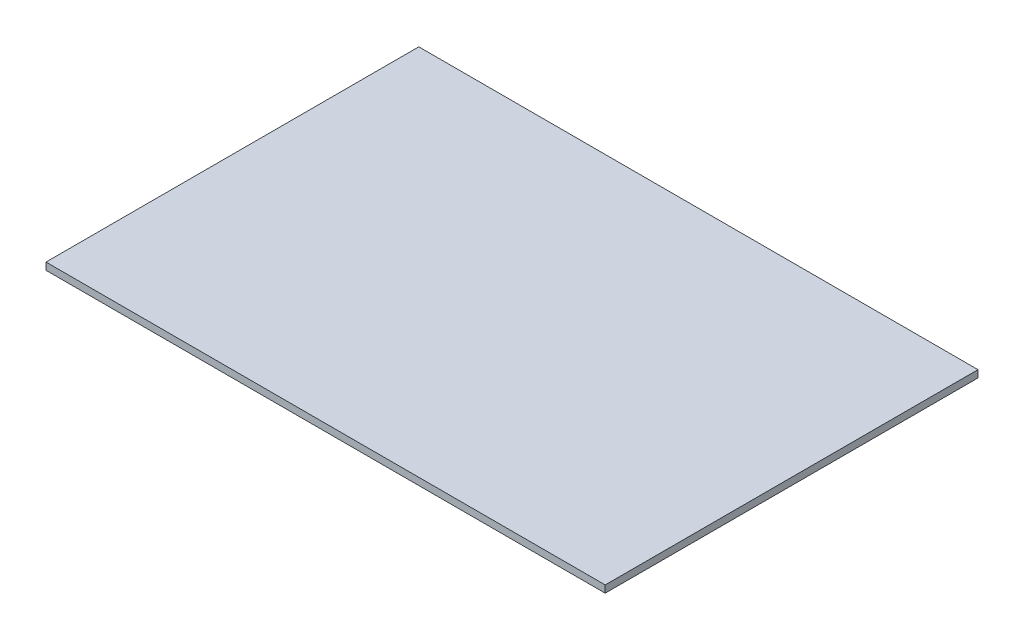
from build123d import *

# Parameters (mm, degrees)
SKETCH_1_W      = 780
SKETCH_1_H      = 520
EXTRUDE_2_DEPTH = 10


with BuildPart() as part:
    # Эскиз1 → Бобышка-Вытянуть2 (new body)
    with BuildSketch(Plane(origin=(0, 0, 0), x_dir=(1, 0, 0), z_dir=(0, 1, 0))):
        with Locations((-390, 260)):
            Rectangle(SKETCH_1_W, SKETCH_1_H)
    extrude(amount=EXTRUDE_2_DEPTH)


solid = part.part
